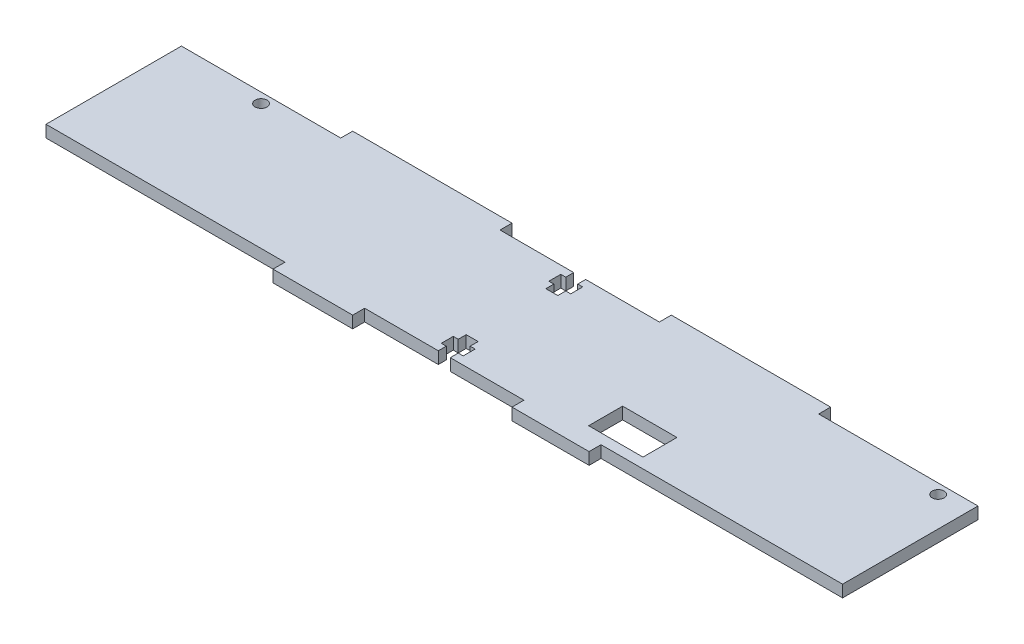
from build123d import *

# Parameters (mm, degrees)
SKETCH1_W           = 200
SKETCH1_H           = 40
BOSS_EXTRUDE1_DEPTH = 3
SKETCH3_W           = 60
SKETCH3_H           = 3
SKETCH3_W_2         = 60.649381746
CUT_EXTRUDE1_DEPTH  = 3
SKETCH4_W           = 13.64
SKETCH4_H           = 8.53
CUT_EXTRUDE2_DEPTH  = 3
SKETCH6_R           = 1.5
CUT_EXTRUDE3_DEPTH  = 3


with BuildPart() as part:
    # Sketch1 → Boss-Extrude1 (new body)
    with BuildSketch(Plane(origin=(0, 0, 0), x_dir=(1, 0, 0), z_dir=(0, 1, 0))):
        Rectangle(SKETCH1_W, SKETCH1_H)
    extrude(amount=BOSS_EXTRUDE1_DEPTH)

    # Sketch3 → Cut-Extrude1 (cut)
    with BuildSketch(Plane(origin=(0, 3, 0), x_dir=(1, 0, 0), z_dir=(0, 1, 0))):
        Polygon((-20, -20), (-20, -17), (-1.5, -17), (-1.5, -15), (-2.75, -15), (-2.75, -12), (-1.5, -12), (-1.5, -10), (1.5, -10), (1.5, -12), (2.75, -12), (2.75, -15), (1.5, -15), (1.5, -17), (20, -17), (20, -20), align=None)
        with Locations((-70, -18.5)):
            Rectangle(SKETCH3_W, SKETCH3_H)
        with Locations((69.675309127, -18.5)):
            Rectangle(SKETCH3_W_2, SKETCH3_H)
        Polygon((85, 17), (100, 17), (100, 20), (60, 20), (60, 17), (82, 17), align=None)
        Polygon((20, 20), (20, 17), (1.5, 17), (1.5, 15), (2.75, 15), (2.75, 12), (1.5, 12), (1.5, 10), (-1.5, 10), (-1.5, 12), (-2.75, 12), (-2.75, 15), (-1.5, 15), (-1.5, 17), (-20, 17), (-20, 20), align=None)
        Polygon((-60, 20), (-60, 17), (-82, 17), (-85, 17), (-100, 17), (-100, 20), align=None)
    extrude(amount=-CUT_EXTRUDE1_DEPTH, mode=Mode.SUBTRACT)

    # Sketch4 → Cut-Extrude2 (cut)
    with BuildSketch(Plane(origin=(0, 3, 0), x_dir=(1, 0, 0), z_dir=(0, 1, 0))):
        with Locations((40.492611387, -10.166269366)):
            Rectangle(SKETCH4_W, SKETCH4_H)
    extrude(amount=-CUT_EXTRUDE2_DEPTH, mode=Mode.SUBTRACT)

    # Sketch6 → Cut-Extrude3 (cut)
    with BuildSketch(Plane.XZ):
        with Locations(Location((92.5, -14.5, 0), (0, 0, 270))):
            Circle(SKETCH6_R)
        with Locations(Location((-77.5, -14.5, 0), (0, 0, 270))):
            Circle(SKETCH6_R)
    extrude(amount=-CUT_EXTRUDE3_DEPTH, mode=Mode.SUBTRACT)


solid = part.part
